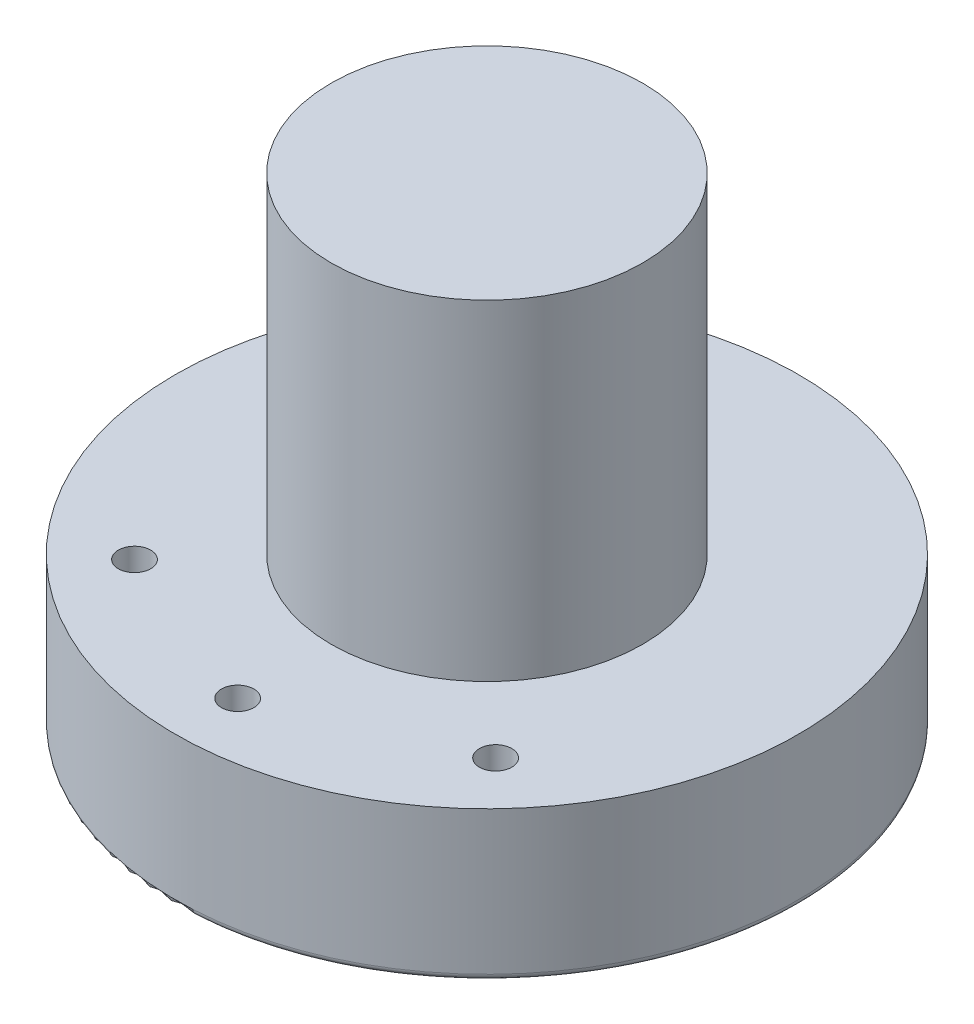
from build123d import *

# Parameters (mm, degrees)
FILLET2_R             = 0.5
F_1_0MM_DOWEL_HOLE1_D = 2.6


with BuildPart() as part:
    # Sketch1 → Revolve1 (revolve)
    with BuildSketch(Plane.XY, mode=Mode.PRIVATE) as revolve1_sk:
        Polygon((0, 0), (6, 0), (6, 1.5), (25, 1.5), (25, 13.5), (12.5, 13.5), (12.5, 40), (0, 40), align=None)
    revolve(revolve1_sk.sketch.rotate(Axis((0, 40, 0), (0, -1, 0)), 180), axis=Axis((0, 40, 0), (0, -1, 0)))

    # Fillet2
    fillet2_edges = [part.edges().sort_by_distance(p)[0] for p in [
        (25, 1.5, 0),
        (6, 0, 0),
    ]]
    fillet(fillet2_edges, radius=FILLET2_R)

    # Ø1.0mm Dowel Hole1 (through all)
    with Locations(Plane(origin=(0, 13.5, 0), x_dir=(1, 0, 0), z_dir=(0, 1, 0))):
        with Locations((14.486070668, -13.789624963), (0, -20), (-13.789624963, -14.486070668)):
            Hole(F_1_0MM_DOWEL_HOLE1_D / 2)


solid = part.part
